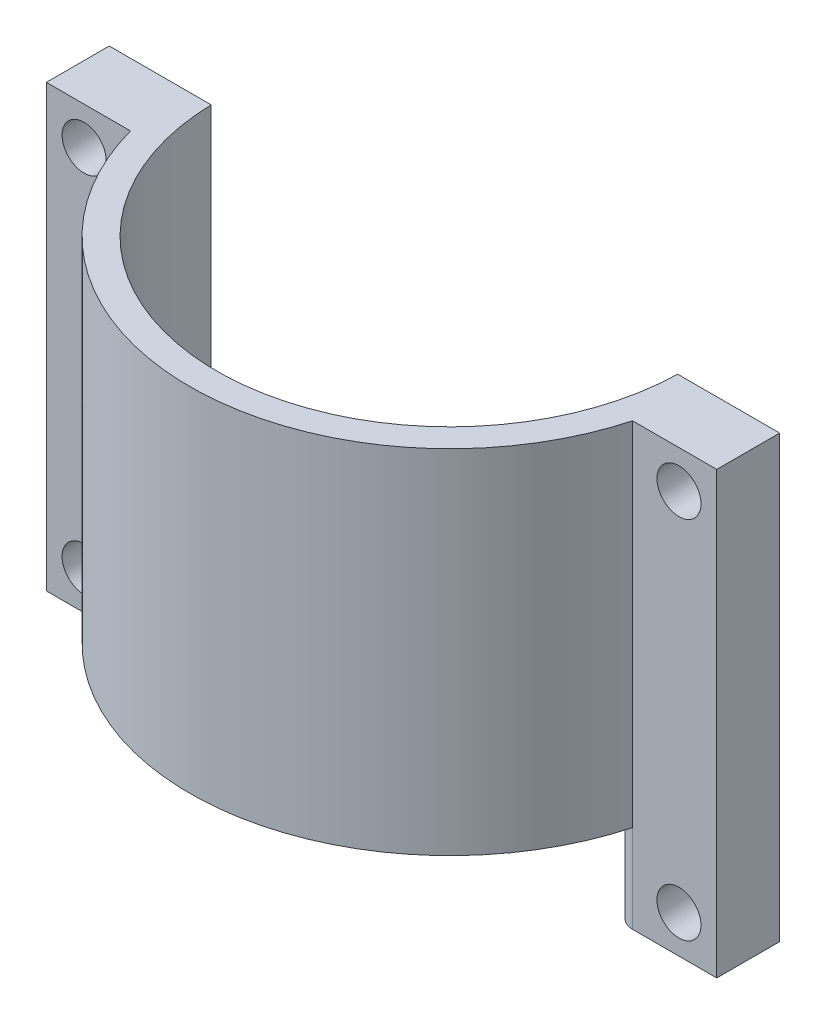
from build123d import *

# Parameters (mm, degrees)
SKETCH1_R             = 1.75
BOSS_EXTRUDE1_DEPTH   = 5
BOSS_EXTRUDE1_2_DEPTH = 5
SKETCH1_2_R           = 1.75
BOSS_EXTRUDE2_DEPTH   = 5
BOSS_EXTRUDE3_DEPTH   = 28
FILLET1_R             = 1.4


with BuildPart() as part:
    # Sketch1 → Boss-Extrude1 (new body)
    with BuildSketch(Plane.XY):
        Polygon((-3, 3), (5.1, 3), (5.1, -32), (-3, -32), (-3, -26), align=None)
        Circle(SKETCH1_R, mode=Mode.SUBTRACT)
        with Locations((0, -29)):
            Circle(SKETCH1_R, mode=Mode.SUBTRACT)
    extrude(amount=BOSS_EXTRUDE1_DEPTH)



with BuildPart() as body_2:
    # Sketch1 → Boss-Extrude1 2 (new body)
    with BuildSketch(Plane.XY):
        Polygon((50.27, 3), (42.17, 3), (42.17, -32), (50.27, -32), (50.27, -26), align=None)
        with Locations((47.27, 0)):
            Circle(SKETCH1_R, mode=Mode.SUBTRACT)
        with Locations((47.27, -29)):
            Circle(SKETCH1_R, mode=Mode.SUBTRACT)
    extrude(amount=BOSS_EXTRUDE1_2_DEPTH)


with BuildPart() as part_1:
    add(part.part)

    add(body_2.part)  # Boss-Extrude2 merges body 2
    # Sketch1<2> → Boss-Extrude2 (add)
    # profile 1 of 2: a face of its own
    with BuildSketch(Plane.XY):
        Polygon((-3, 3), (5.1, 3), (5.1, -32), (-3, -32), (-3, -26), align=None)
        Circle(SKETCH1_2_R, mode=Mode.SUBTRACT)
        with Locations((0, -29)):
            Circle(SKETCH1_2_R, mode=Mode.SUBTRACT)
    # profile 2 of 2: a face of its own
    with BuildSketch(Plane.XY):
        Polygon((50.27, 3), (42.17, 3), (42.17, -32), (50.27, -32), (50.27, -26), align=None)
        with Locations((47.27, 0)):
            Circle(SKETCH1_2_R, mode=Mode.SUBTRACT)
        with Locations((47.27, -29)):
            Circle(SKETCH1_2_R, mode=Mode.SUBTRACT)
    extrude(amount=BOSS_EXTRUDE2_DEPTH)

    # Sketch2 → Boss-Extrude3 (add)
    with BuildSketch(Plane(origin=(0, 3, 0), x_dir=(1, 0, 0), z_dir=(0, 1, 0))):
        with BuildLine():
            Line((42.17, 0), (44.305, 0))
            ThreePointArc((44.305, 0), (23.635, -20.235462541), (2.965, 0))
            Line((2.965, 0), (5.1, 0))
            ThreePointArc((5.1, 0), (23.635, -18.100999821), (42.17, 0))
        make_face()
    extrude(amount=-BOSS_EXTRUDE3_DEPTH)

    # Fillet1
    fillet1_edges = [part_1.edges().sort_by_distance(p)[0] for p in [
        (42.17, -28.5, 5),
        (5.1, -28.5, 5),
    ]]
    fillet(fillet1_edges, radius=FILLET1_R)


solid = part_1.part
